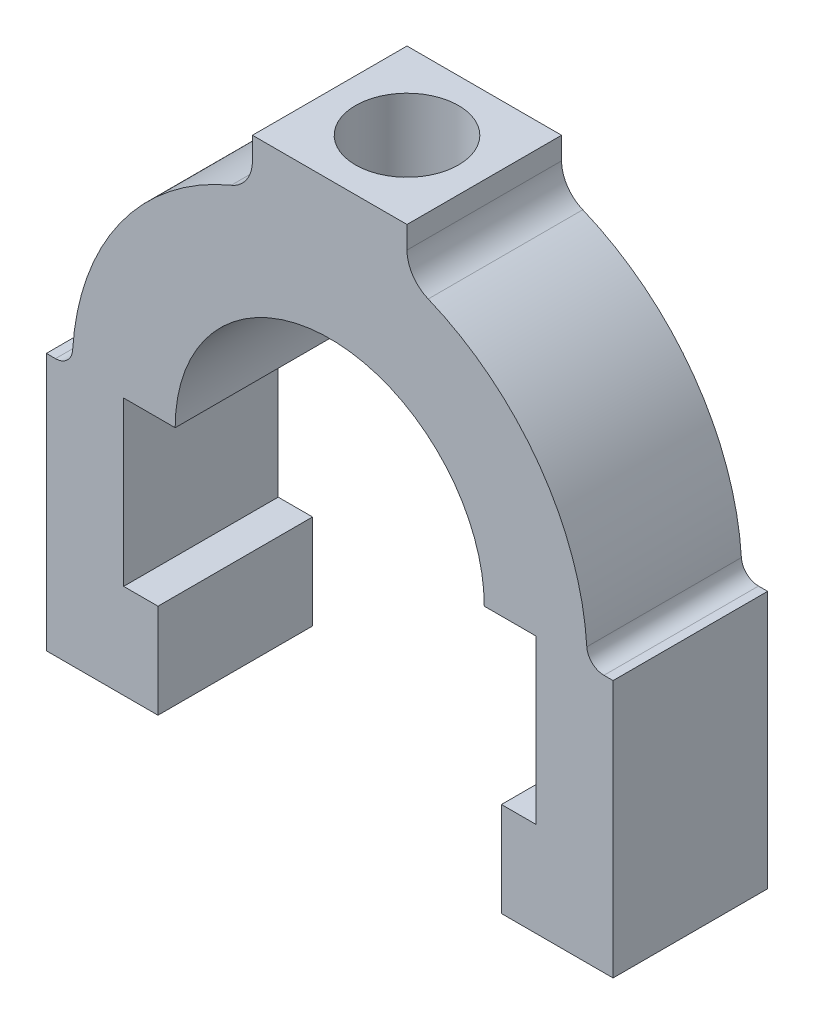
from build123d import *

# Parameters (mm, degrees)
BOSS_EXTRUDE1_DEPTH = 9
FILLET1_R           = 4
FILLET2_R           = 2
HOLE1_D             = 12


with BuildPart() as part:
    # Sketch1 → Boss-Extrude1 (new, symmetric)
    with BuildSketch(Plane.XY):
        with BuildLine():
            Line((-18, 0), (-24, 0))
            Line((-24, 0), (-24, -19))
            Line((-24, -19), (-20, -19))
            Line((-20, -19), (-20, -30))
            Line((-20, -30), (-33, -30))
            Line((-33, -30), (-33, 0))
            Line((-33, 0), (-30, 0))
            ThreePointArc((-30, 0), (-24.186773245, 17.748239349), (-9, 28.618176043))
            Line((-9, 28.618176043), (-9, 34))
            Line((-9, 34), (9, 34))
            Line((9, 34), (9, 28.618176043))
            ThreePointArc((9, 28.618176043), (24.186773245, 17.748239349), (30, 0))
            Line((30, 0), (33, 0))
            Line((33, 0), (33, -30))
            Line((33, -30), (20, -30))
            Line((20, -30), (20, -19))
            Line((20, -19), (24, -19))
            Line((24, -19), (24, 0))
            Line((24, 0), (18, 0))
            ThreePointArc((18, 0), (0, 18), (-18, 0))
        make_face()
    extrude(amount=BOSS_EXTRUDE1_DEPTH, both=True)

    # Fillet1
    fillet1_edges = [part.edges().sort_by_distance(p)[0] for p in [
        (-9, 28.618176043, 0),
        (9, 28.618176043, 0),
    ]]
    fillet(fillet1_edges, radius=FILLET1_R)

    # Fillet2
    fillet2_edges = [part.edges().sort_by_distance(p)[0] for p in [
        (30, 0, 0),
        (-30, 0, 0),
    ]]
    fillet(fillet2_edges, radius=FILLET2_R)

    # Hole1 (through all)
    with Locations(Plane(origin=(0, 34, 0), x_dir=(1, 0, 0), z_dir=(0, 1, 0))):
        with Locations((0, 0)):
            Hole(HOLE1_D / 2)


solid = part.part
